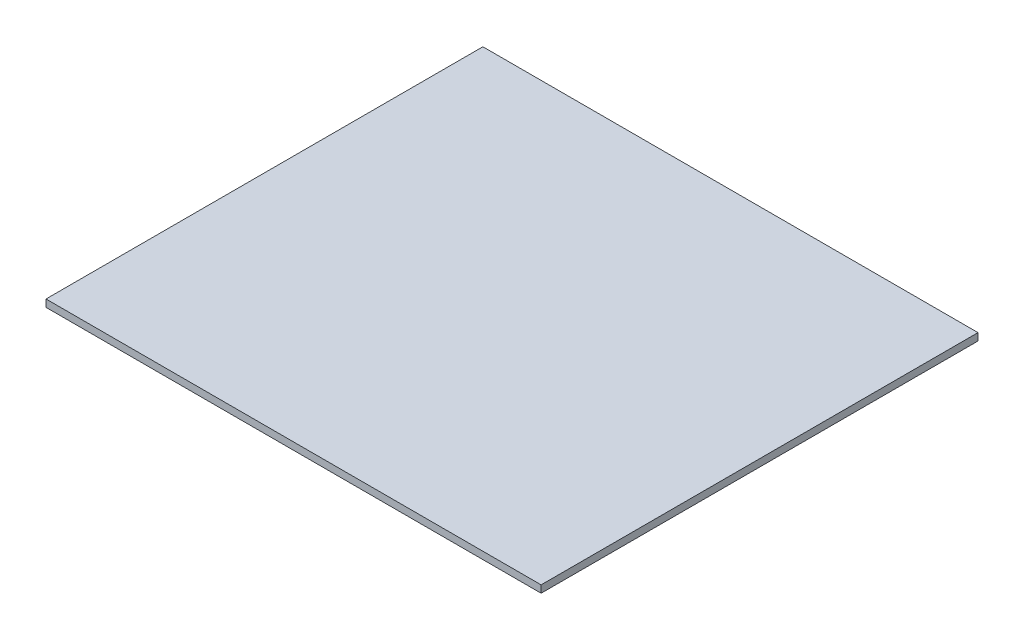
from build123d import *

# Parameters (mm, degrees)
SKETCH_1_W      = 340
SKETCH_1_H      = 300
EXTRUDE_1_DEPTH = 5


with BuildPart() as part:
    # 스케치1 → 보스-돌출1 (new body)
    with BuildSketch(Plane(origin=(0, 0, 0), x_dir=(1, 0, 0), z_dir=(0, 1, 0))):
        with Locations((170, 150)):
            Rectangle(SKETCH_1_W, SKETCH_1_H)
    extrude(amount=EXTRUDE_1_DEPTH)


solid = part.part
